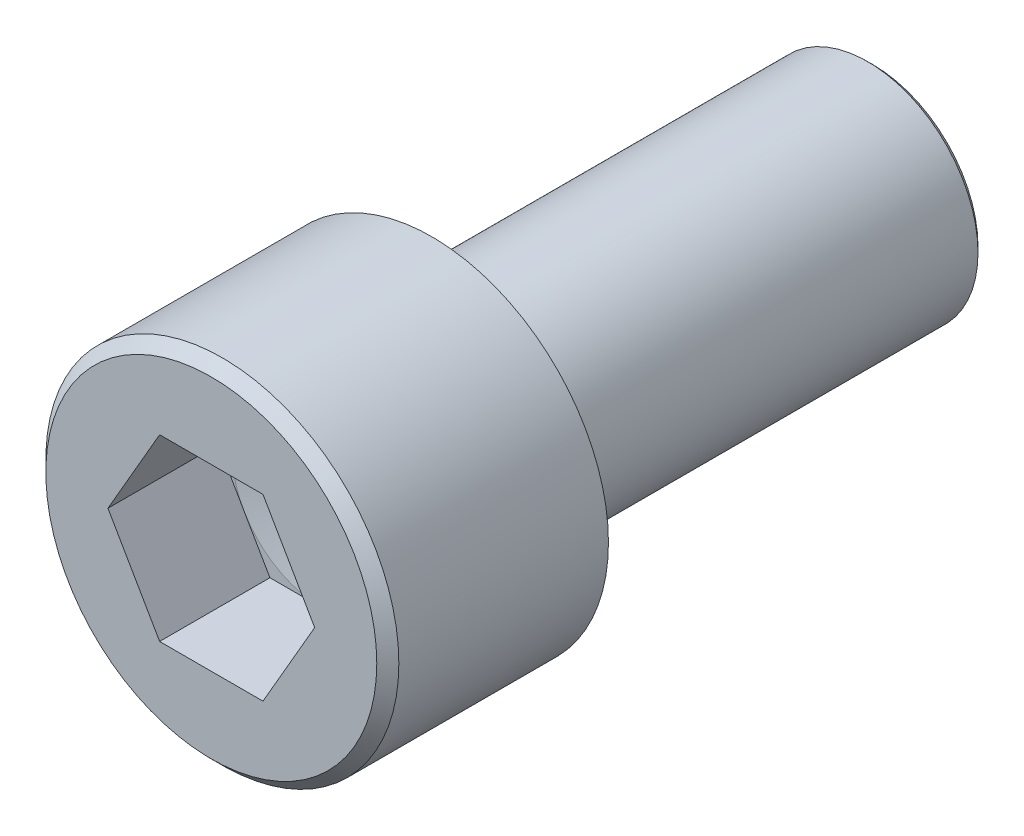
from build123d import *

# Parameters (mm, degrees)
IZIM1_R                = 8
KAFA_YUKSEKLIGI_DEPTH  = 10
PAH1_SIZE              = 0.5
ALTIGEN_BOSALTMA_DEPTH = 5
IZIM5_W                = 5
IZIM5_H                = 20
RADYUS1_R              = 0.25
PAH2_SIZE              = 0.25


with BuildPart() as part:
    # Çizim1 → KAFA_YUKSEKLIGI (new body)
    with BuildSketch(Plane.XY):
        Circle(IZIM1_R)
    extrude(amount=KAFA_YUKSEKLIGI_DEPTH)

    # Pah1
    pah1_edges = [part.edges().sort_by_distance(p)[0] for p in [
        (-8, 0, 10),
    ]]
    chamfer(pah1_edges, length=PAH1_SIZE)

    # Çizim2 → ALTIGEN_BOSALTMA (cut)
    with BuildSketch(Plane.XY.offset(10)):
        Polygon((-4.685, 0), (-2.3425, -4.057329017), (2.3425, -4.057329017), (4.685, 0), (2.3425, 4.057329017), (-2.3425, 4.057329017), align=None)
    extrude(amount=-ALTIGEN_BOSALTMA_DEPTH, mode=Mode.SUBTRACT)

    # Kes-Ekstrüzyon2 cone 1 section (through the dimple's axis) → Kes-Ekstrüzyon2 (revolve, cut)
    with BuildSketch(Plane(origin=(0, 0, 5), x_dir=(0, -1, 0), z_dir=(1, 0, 0))):
        Polygon((0, 0), (4.057329017, 0), (0, 0.715416575), align=None)
    revolve(axis=Axis((0, 0, 5), (0, 0, -1)), mode=Mode.SUBTRACT)

    # Çizim5 → Döndür1 (revolve)
    with BuildSketch(Plane(origin=(0, 0, 0), x_dir=(1, 0, 0), z_dir=(0, 1, 0))):
        with Locations((2.5, 10)):
            Rectangle(IZIM5_W, IZIM5_H)
    revolve(axis=Axis((0, 0, 0), (0, 0, -1)))

    # Radyus1
    radyus1_edges = [part.edges().sort_by_distance(p)[0] for p in [
        (-5, 0, 0),
    ]]
    fillet(radyus1_edges, radius=RADYUS1_R)

    # Pah2
    pah2_edges = [part.edges().sort_by_distance(p)[0] for p in [
        (-5, 0, -20),
    ]]
    chamfer(pah2_edges, length=PAH2_SIZE)


solid = part.part
